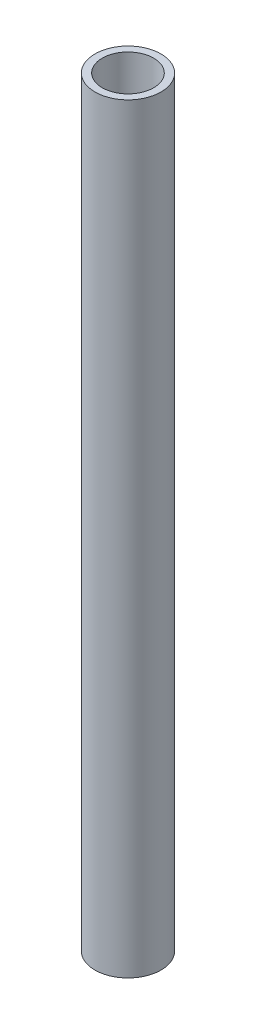
from build123d import *

# Parameters (mm, degrees)
SKETCH1_R           = 10.85
SKETCH1_R_2         = 8.45
BOSS_EXTRUDE1_DEPTH = 250


with BuildPart() as part:
    # Sketch1 → Boss-Extrude1 (new body)
    with BuildSketch(Plane(origin=(0, 0, 0), x_dir=(1, 0, 0), z_dir=(0, 1, 0))):
        with Locations(Location((0, 0, 0), (0, 0, 270))):
            Circle(SKETCH1_R)
        with Locations(Location((0, 0, 0), (0, 0, 270))):
            Circle(SKETCH1_R_2, mode=Mode.SUBTRACT)
    extrude(amount=BOSS_EXTRUDE1_DEPTH)


solid = part.part
